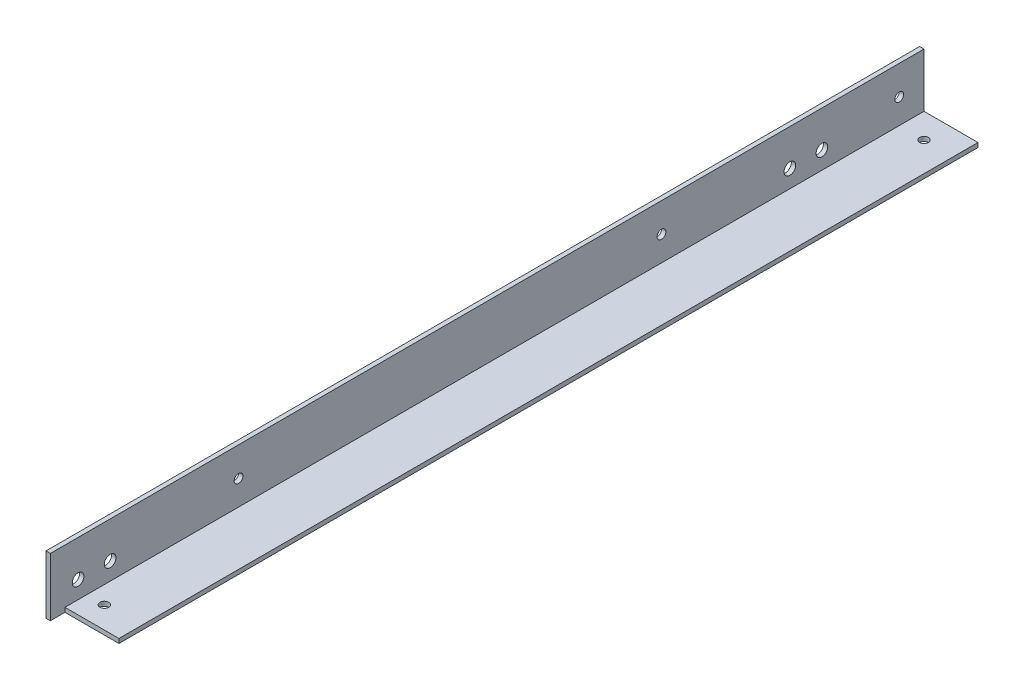
from build123d import *

# Parameters (mm, degrees)
EXTRUSION1_DEPTH = 294.5
ESQUISSE2_R      = 1.5
EXTRUSION2_DEPTH = 300
ESQUISSE3_R      = 1.5
ESQUISSE3_R_2    = 2
EXTRUSION3_DEPTH = 300
ESQUISSE4_W      = 1.5
ESQUISSE4_H      = 20
EXTRUSION4_DEPTH = 5
ESQUISSE5_R      = 1.5
EXTRUSION5_DEPTH = 5


with BuildPart() as part:
    # Esquisse1 → Extrusion1 (new body)
    with BuildSketch(Plane.XY):
        Polygon((-17.43168638, 4.773368421), (-17.43168638, -15.226631579), (2.56831362, -15.226631579), (2.56831362, -13.726631579), (-15.93168638, -13.726631579), (-15.93168638, 4.773368421), align=None)
    extrude(amount=EXTRUSION1_DEPTH)

    # Esquisse2 → Extrusion2 (cut)
    with BuildSketch(Plane(origin=(0, -13.726631579, 0), x_dir=(-1, 0, 0), z_dir=(0, 1, 0))):
        with Locations((7.43168638, 8.5)):
            Circle(ESQUISSE2_R)
    extrude(amount=-EXTRUSION2_DEPTH, mode=Mode.SUBTRACT)

    # Esquisse3 → Extrusion3 (cut)
    with BuildSketch(Plane(origin=(-15.93168638, 0, 0), x_dir=(0, 0, -1), z_dir=(1, 0, 0))):
        with Locations((-8.5, -5.226631579)):
            Circle(ESQUISSE3_R)
        with Locations((-35, -7.726631579)):
            Circle(ESQUISSE3_R_2)
        with Locations((-46, -7.726631579)):
            Circle(ESQUISSE3_R_2)
        with Locations((-290, -7.726631579)):
            Circle(ESQUISSE3_R_2)
        with Locations((-279, -7.726631579)):
            Circle(ESQUISSE3_R_2)
        with Locations((-235, -5.226631579)):
            Circle(ESQUISSE3_R)
        with Locations((-90, -5.226631579)):
            Circle(ESQUISSE3_R)
    extrude(amount=-EXTRUSION3_DEPTH, mode=Mode.SUBTRACT)

    # Esquisse4 → Extrusion4 (add)
    with BuildSketch(Plane.XY.offset(294.5)):
        with Locations((-16.68168638, -5.226631579)):
            Rectangle(ESQUISSE4_W, ESQUISSE4_H)
    extrude(amount=EXTRUSION4_DEPTH)

    # Esquisse5 → Extrusion5 (cut)
    with BuildSketch(Plane.XZ.offset(15.226631579)):
        with Locations(Location((-9.93168638, 287, 0), (0, 0, 270))):
            Circle(ESQUISSE5_R)
    extrude(amount=-EXTRUSION5_DEPTH, mode=Mode.SUBTRACT)


solid = part.part
